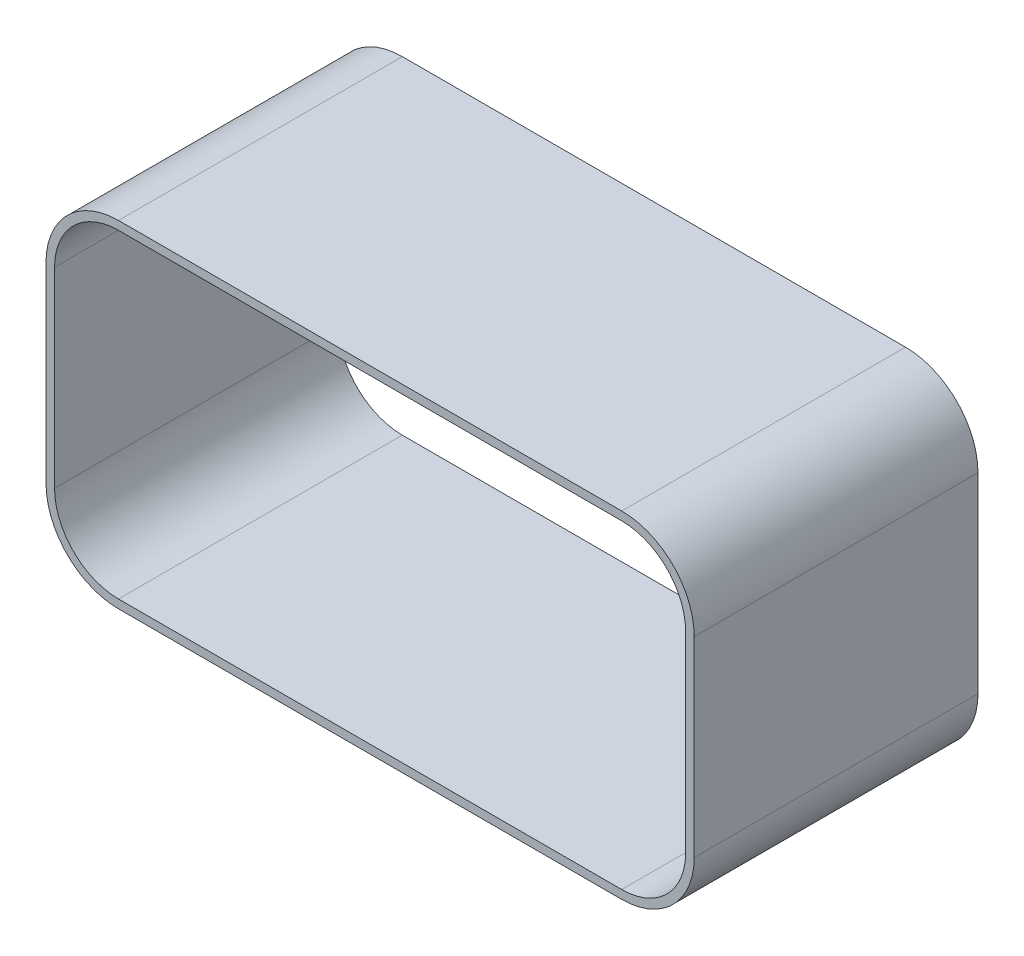
from build123d import *

# Parameters (mm, degrees)
BOSS_EXTRUDE1_DEPTH = 99.5


with BuildPart() as part:
    # Sketch1 → Boss-Extrude1 (new body)
    with BuildSketch(Plane.XY):
        with BuildLine():
            Line((-88.21629769, 58.972672896), (88.21629769, 58.972672896))
            ThreePointArc((88.21629769, 58.972672896), (106.194719556, 51.525766729), (113.641625723, 33.547344863))
            Line((113.641625723, 33.547344863), (113.641625723, -33.547344863))
            ThreePointArc((113.641625723, -33.547344863), (106.194719556, -51.525766729), (88.21629769, -58.972672896))
            Line((88.21629769, -58.972672896), (-88.21629769, -58.972672896))
            ThreePointArc((-88.21629769, -58.972672896), (-106.194719556, -51.525766729), (-113.641625723, -33.547344863))
            Line((-113.641625723, -33.547344863), (-113.641625723, 33.547344863))
            ThreePointArc((-113.641625723, 33.547344863), (-106.194719556, 51.525766729), (-88.21629769, 58.972672896))
        make_face()
        with BuildLine():
            Line((-88.21629769, 55.972672896), (88.21629769, 55.972672896))
            ThreePointArc((88.21629769, 55.972672896), (104.073399212, 49.404446385), (110.641625723, 33.547344863))
            Line((110.641625723, 33.547344863), (110.641625723, -33.547344863))
            ThreePointArc((110.641625723, -33.547344863), (104.073399212, -49.404446385), (88.21629769, -55.972672896))
            Line((88.21629769, -55.972672896), (-88.21629769, -55.972672896))
            ThreePointArc((-88.21629769, -55.972672896), (-104.073399212, -49.404446385), (-110.641625723, -33.547344863))
            Line((-110.641625723, -33.547344863), (-110.641625723, 33.547344863))
            ThreePointArc((-110.641625723, 33.547344863), (-104.073399212, 49.404446385), (-88.21629769, 55.972672896))
        make_face(mode=Mode.SUBTRACT)
    extrude(amount=BOSS_EXTRUDE1_DEPTH)


solid = part.part
